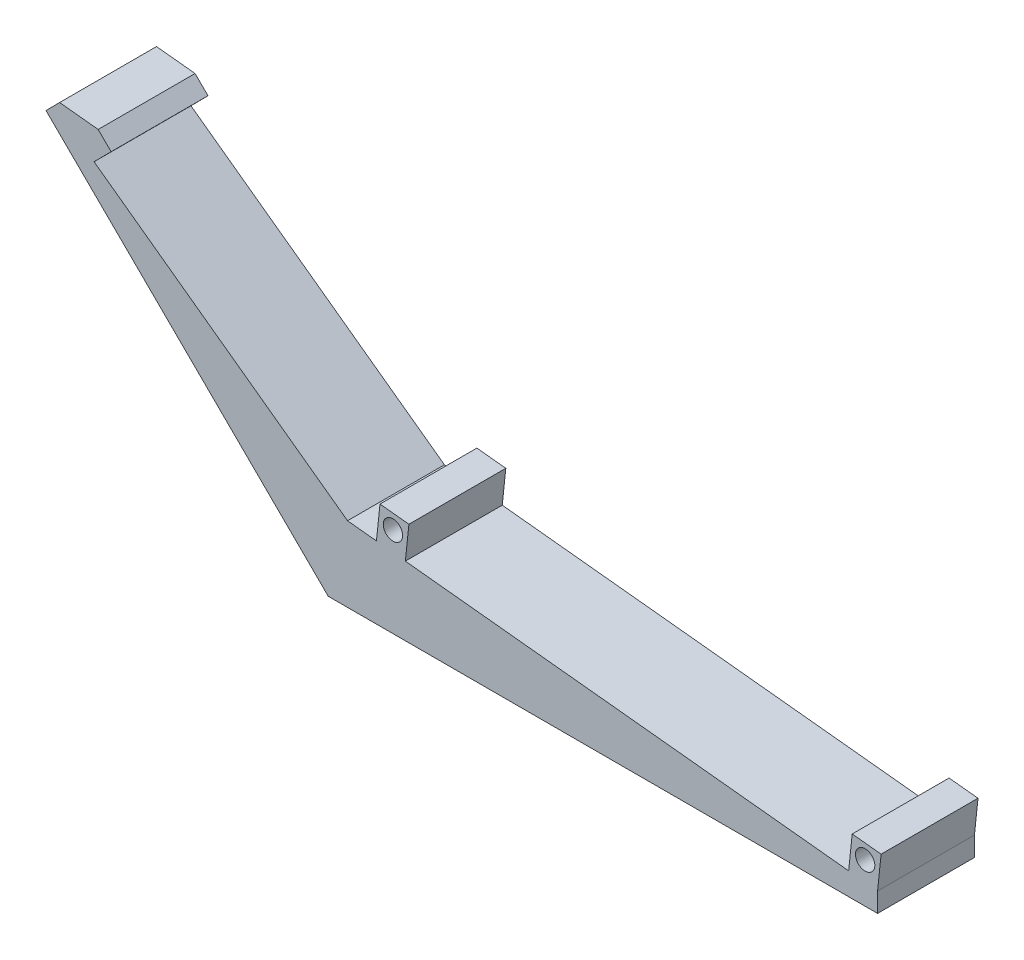
from build123d import *

# Parameters (mm, degrees)
SKETCH1_R           = 1
BOSS_EXTRUDE1_DEPTH = 10


with BuildPart() as part:
    # Sketch1 → Boss-Extrude1 (new body)
    with BuildSketch(Plane.XY):
        Polygon((0, 0), (56.686664051, 0), (56.686664051, 2), (56.895720978, 3.989043791), (57.052513673, 5.480826634), (54.068947987, 5.794412024), (53.912155292, 4.302629181), (53.703098365, 2.31358539), (7.955091178, 7.1218947), (8.164148105, 9.110938491), (8.3209408, 10.602721334), (5.337375114, 10.916306724), (5.180582419, 9.424523881), (4.971525492, 7.43548009), (1.987959806, 7.74906548), (-24.170435964, 26.754252471), (-22.411181701, 28.530491317), (-23.74645795, 29.852999514), (-27.724545531, 30.271113368), (-29.130317066, 28.851769922), align=None)
        with Locations((55.403938135, 4.145836486)):
            Circle(SKETCH1_R, mode=Mode.SUBTRACT)
        with Locations((6.672365262, 9.267731186)):
            Circle(SKETCH1_R, mode=Mode.SUBTRACT)
    extrude(amount=BOSS_EXTRUDE1_DEPTH)


solid = part.part
